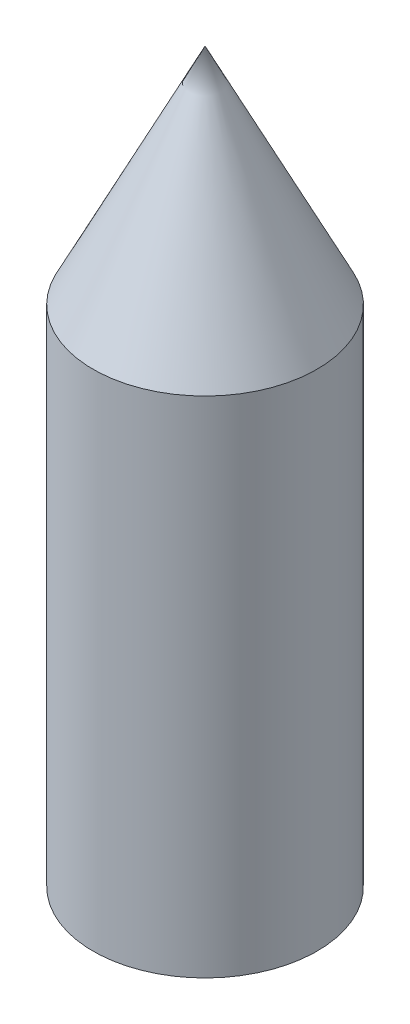
from build123d import *


with BuildPart() as part:
    # Esboço1 → Revolução1 (revolve)
    with BuildSketch(Plane.XY, mode=Mode.PRIVATE) as revolu_o1_sk:
        Polygon((20, 0), (0, 0), (0, 130), (20, 90), align=None)
    revolve(revolu_o1_sk.sketch.rotate(Axis((0, 0, 0), (0, 1, 0)), 90), axis=Axis((0, 0, 0), (0, 1, 0)))


solid = part.part
